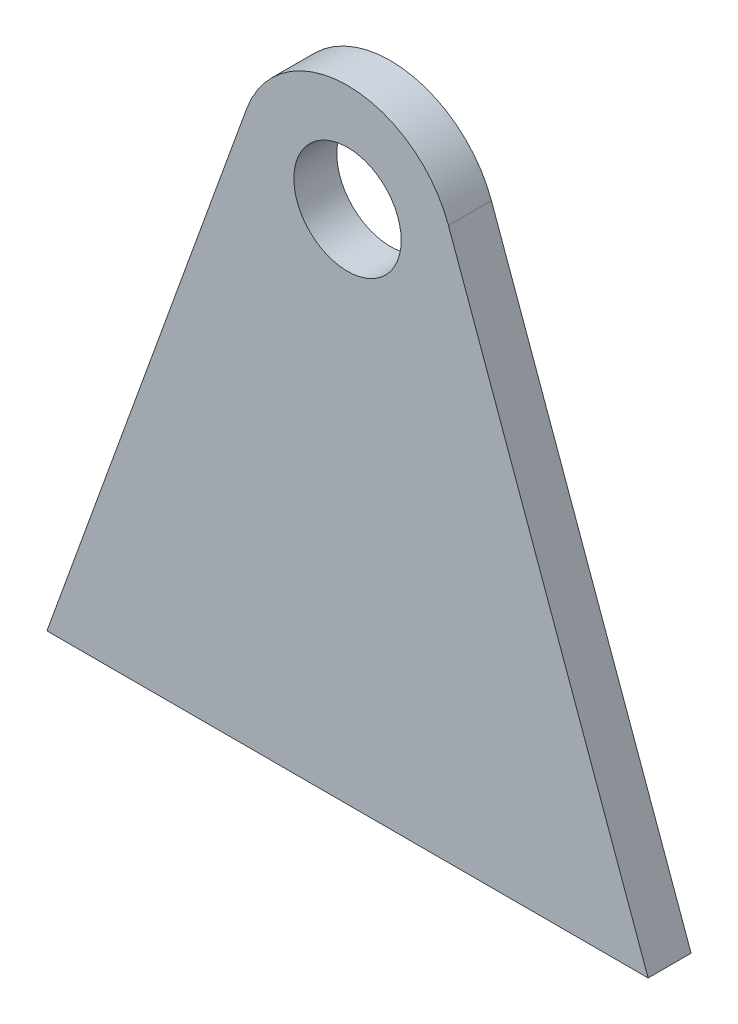
from build123d import *

# Parameters (mm, degrees)
SKETCH_1_R      = 25
EXTRUDE_1_DEPTH = 20


with BuildPart() as part:
    # 草圖1 → 擠出1 (new body)
    with BuildSketch(Plane.XY):
        with BuildLine():
            Line((140, 0), (47.017565913, 257.010246783))
            ThreePointArc((47.017565913, 257.010246783), (0, 290), (-47.017565913, 257.010246783))
            Line((-47.017565913, 257.010246783), (-140, 0))
            Line((-140, 0), (0, 0))
            Line((0, 0), (140, 0))
        make_face()
        with Locations((0, 240)):
            Circle(SKETCH_1_R, mode=Mode.SUBTRACT)
    extrude(amount=-EXTRUDE_1_DEPTH)


solid = part.part
